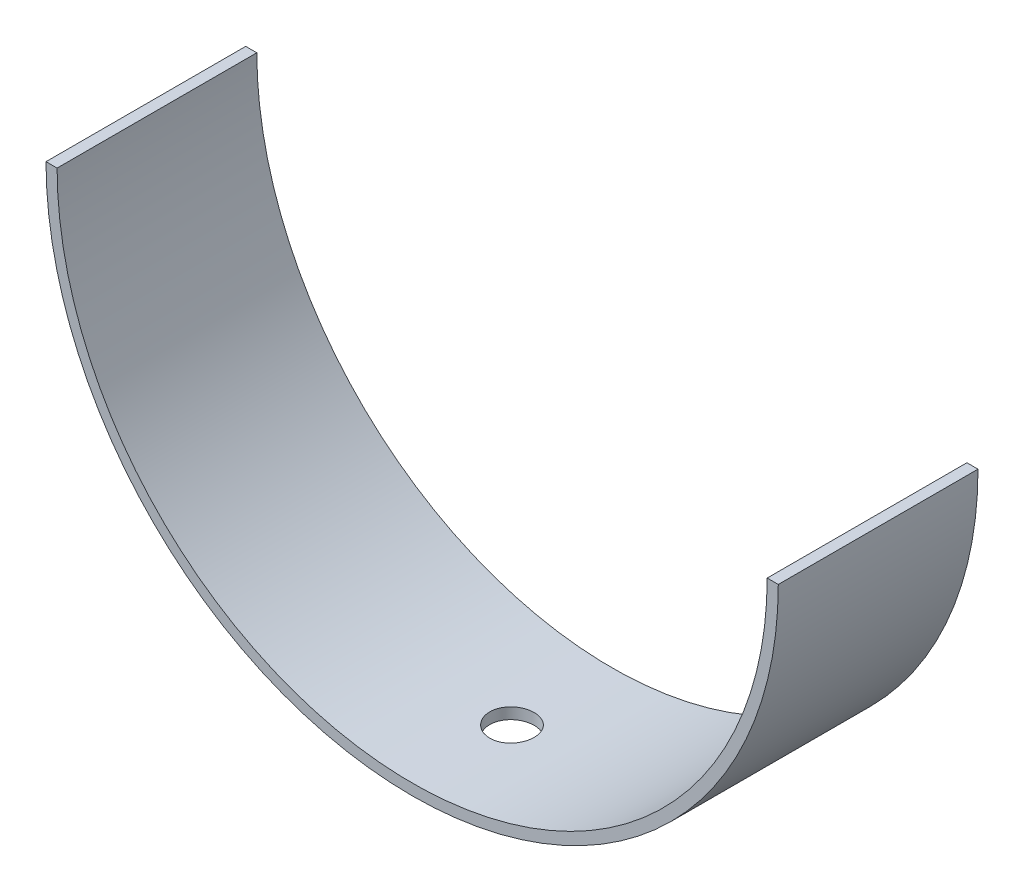
from build123d import *

# Parameters (mm, degrees)
SALIENTE_EXTRUIR1_DEPTH = 9
CROQUIS2_R              = 2
CORTAR_EXTRUIR1_DEPTH   = 10


with BuildPart() as part:
    # Croquis1 → Saliente-Extruir1 (new, symmetric)
    with BuildSketch(Plane.XY):
        with BuildLine():
            Line((-32, 0), (-33, 0))
            ThreePointArc((-33, 0), (0, -33), (33, 0))
            Line((33, 0), (32, 0))
            ThreePointArc((32, 0), (0, -32), (-32, 0))
        make_face()
    extrude(amount=SALIENTE_EXTRUIR1_DEPTH, both=True)

    # Croquis2 → Cortar-Extruir1 (cut)
    with BuildSketch(Plane.XZ.offset(33)):
        with Locations(Location((0, 0, 0), (0, 0, 270))):
            Circle(CROQUIS2_R)
    extrude(amount=-CORTAR_EXTRUIR1_DEPTH, mode=Mode.SUBTRACT)


solid = part.part
